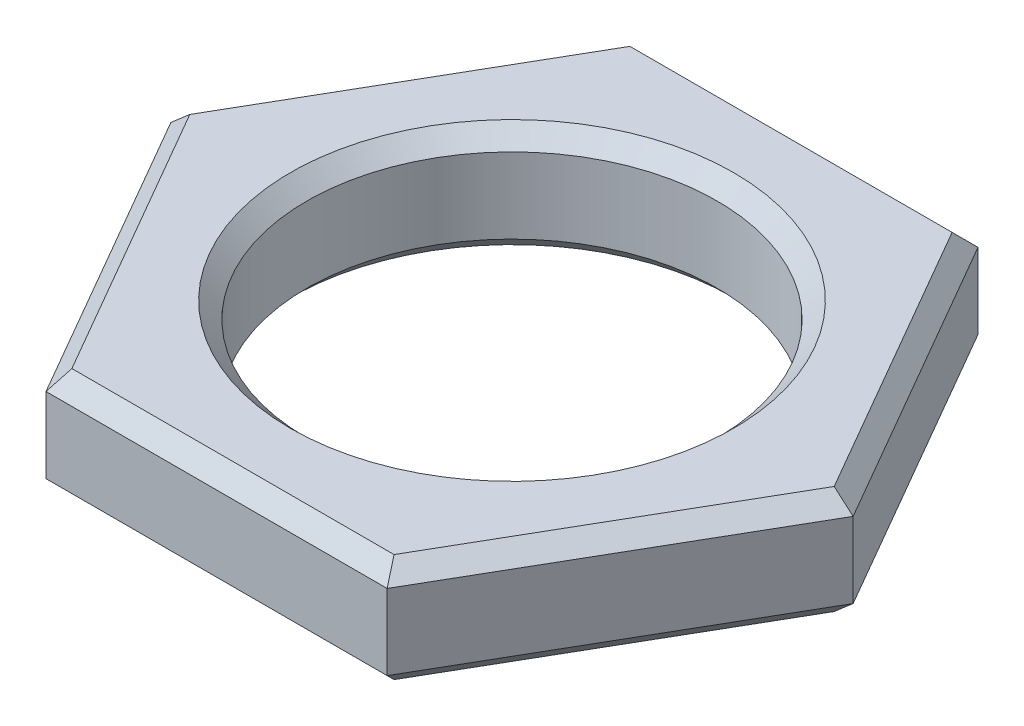
from build123d import *

# Parameters (mm, degrees)
SKETCH1_R           = 3.125
BOSS_EXTRUDE1_DEPTH = 1.65
CHAMFER1_SIZE       = 0.25


with BuildPart() as part:
    # Sketch1 → Boss-Extrude1 (new body)
    with BuildSketch(Plane(origin=(0, 0, 0), x_dir=(1, 0, 0), z_dir=(0, 1, 0))):
        Polygon((5.196152423, 0), (2.598076211, 4.5), (-2.598076211, 4.5), (-5.196152423, 0), (-2.598076211, -4.5), (2.598076211, -4.5), align=None)
        with Locations(Location((0, 0, 0), (0, 0, 270))):
            Circle(SKETCH1_R, mode=Mode.SUBTRACT)
    extrude(amount=BOSS_EXTRUDE1_DEPTH)

    # Chamfer1
    chamfer1_edges = [part.edges().sort_by_distance(p)[0] for p in [
        (3.897114317, 0, -2.25),
        (3.897114317, 1.65, -2.25),
        (0, 0, -4.5),
        (0, 1.65, -4.5),
        (-3.897114317, 0, -2.25),
        (-3.897114317, 1.65, -2.25),
        (-3.897114317, 0, 2.25),
        (-3.897114317, 1.65, 2.25),
        (0, 0, 4.5),
        (0, 1.65, 4.5),
        (3.897114317, 0, 2.25),
        (3.897114317, 1.65, 2.25),
        (0, 0, -3.125),
        (0, 1.65, -3.125),
    ]]
    chamfer(chamfer1_edges, length=CHAMFER1_SIZE)


solid = part.part
